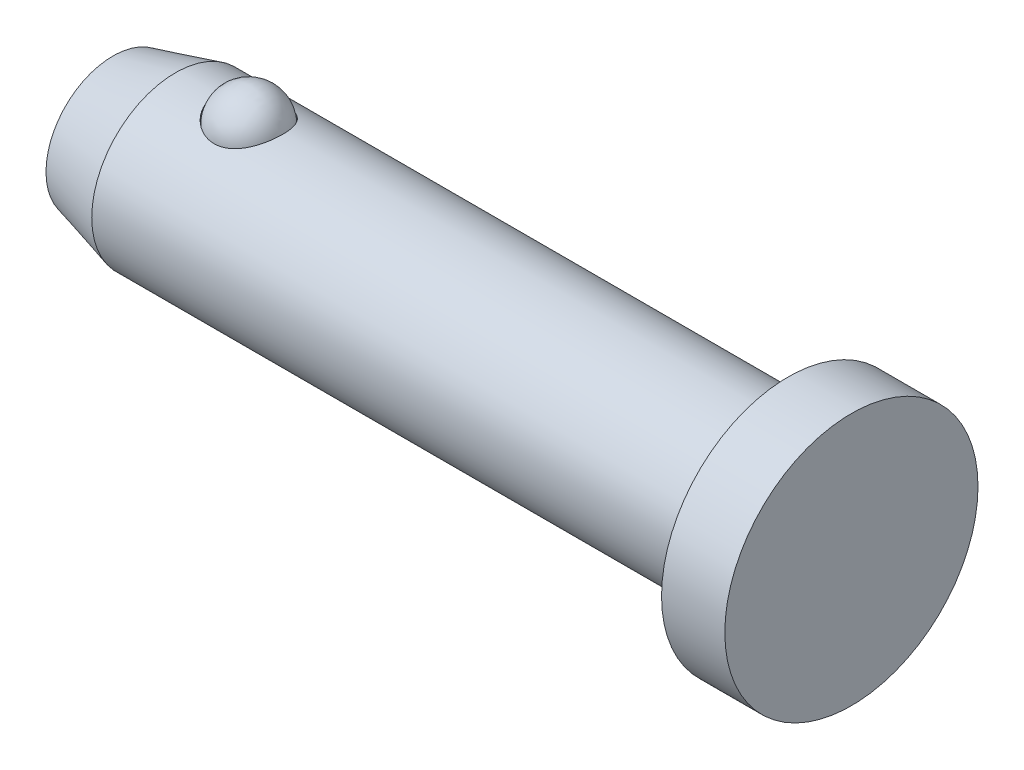
from build123d import *


with BuildPart() as part:
    # Sketch1 → Revolve1 (revolve)
    with BuildSketch(Plane.XY, mode=Mode.PRIVATE) as revolve1_sk:
        Polygon((2.38125, 4.7625), (0, 4.7625), (0, 3.1496), (-23.049106555, 3.1496), (-25.4, 2.51968), (-25.4, 0), (2.38125, 0), align=None)
    revolve(revolve1_sk.sketch.rotate(Axis((2.38125, 0, 0), (1, 0, 0)), 90), axis=Axis((2.38125, 0, 0), (1, 0, 0)))

    # Sketch2 → Cut-Revolve1 (revolve, cut)
    with BuildSketch(Plane.XY):
        with BuildLine():
            Line((-18.985250148, 2.83464), (-21.596370148, 2.83464))
            ThreePointArc((-21.596370148, 2.83464), (-20.290810148, 4.1402), (-18.985250148, 2.83464))
        make_face()
    revolve(axis=Axis((-18.985250148, 2.83464, 0), (1, 0, 0)), mode=Mode.SUBTRACT)


with BuildPart() as body_2:
    # Sketch3 → Revolve2 (revolve)
    with BuildSketch(Plane.XY):
        with BuildLine():
            Line((-19.010650148, 2.83464), (-21.570970148, 2.83464))
            ThreePointArc((-21.570970148, 2.83464), (-20.290810148, 4.1148), (-19.010650148, 2.83464))
        make_face()
    revolve(axis=Axis((-19.010650148, 2.83464, 0), (1, 0, 0)))


solid = Compound([part.part, body_2.part])
